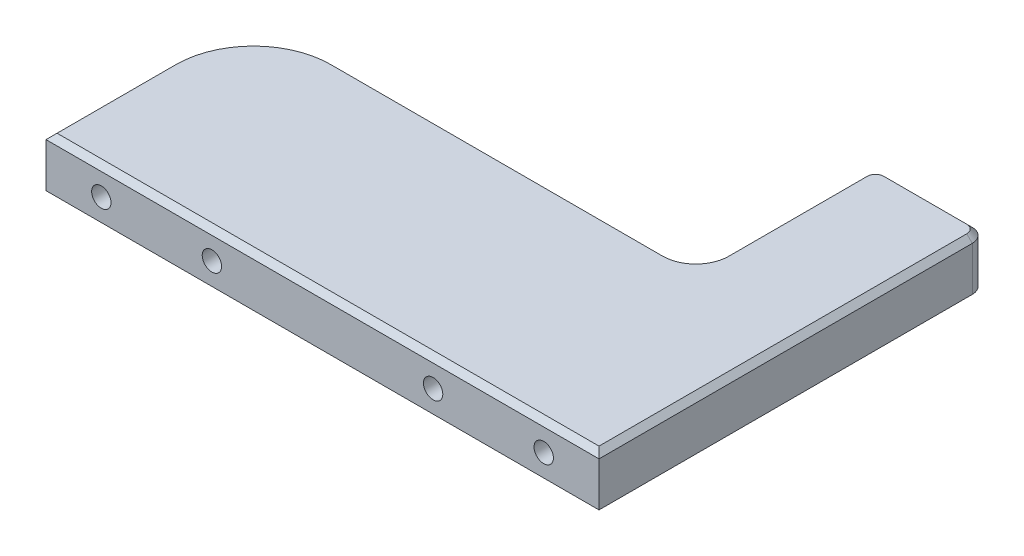
from build123d import *

# Parameters (mm, degrees)
BOSS_EXTRUDE1_DEPTH      = 20
FILLET1_R                = 10
M6_CLEARANCE_HOLE1_D     = 7
M6_CLEARANCE_HOLE1_DEPTH = 40
FILLET2_R                = 5
FILLET3_R                = 30
CHAMFER1_SIZE            = 2


with BuildPart() as part:
    # Sketch1 → Boss-Extrude1 (new body)
    with BuildSketch(Plane(origin=(0, 0, 0), x_dir=(1, 0, 0), z_dir=(0, 1, 0))):
        Polygon((0, 0), (0, -140), (-200, -140), (-200, -65), (-40, -65), (-40, 0), align=None)
    extrude(amount=BOSS_EXTRUDE1_DEPTH)

    # Fillet1
    fillet1_edges = [part.edges().sort_by_distance(p)[0] for p in [
        (-40, 10, 65),
    ]]
    fillet(fillet1_edges, radius=FILLET1_R)

    # M6 Clearance Hole1
    with Locations(Plane(origin=(10895.274804619, -492.997703293, 140), x_dir=(1, 0, 0), z_dir=(0, 0, 1))):
        with Locations((-11075.274804618, 502.997703293), (-11035.274804618, 502.997703293), (-10955.274804618, 502.997703293), (-10915.274804618, 502.997703293)):
            Hole(M6_CLEARANCE_HOLE1_D / 2, depth=M6_CLEARANCE_HOLE1_DEPTH)

    # Fillet2
    fillet2_edges = [part.edges().sort_by_distance(p)[0] for p in [
        (0, 10, 0),
        (-40, 10, 0),
    ]]
    fillet(fillet2_edges, radius=FILLET2_R)

    # Fillet3
    fillet3_edges = [part.edges().sort_by_distance(p)[0] for p in [
        (-200, 10, 65),
    ]]
    fillet(fillet3_edges, radius=FILLET3_R)

    # Chamfer1
    chamfer1_edges = [part.edges().sort_by_distance(p)[0] for p in [
        (-110, 0, 65),
        (-110, 20, 65),
        (-100, 20, 140),
        (-42.928932188, 0, 62.071067812),
        (-42.928932188, 20, 62.071067812),
        (0, 20, 72.5),
        (-20, 0, 0),
        (-20, 20, 0),
        (-40, 0, 30),
        (-38.535533906, 0, 1.464466094),
        (-1.464466094, 0, 1.464466094),
        (-40, 20, 30),
        (-38.535533906, 20, 1.464466094),
        (-1.464466094, 20, 1.464466094),
        (-200, 0, 117.5),
        (-200, 20, 117.5),
        (-191.213203436, 0, 73.786796564),
        (-191.213203436, 20, 73.786796564),
        (0, 0, 72.5),
        (-100, 0, 140),
    ]]
    chamfer(chamfer1_edges, length=CHAMFER1_SIZE)


solid = part.part
